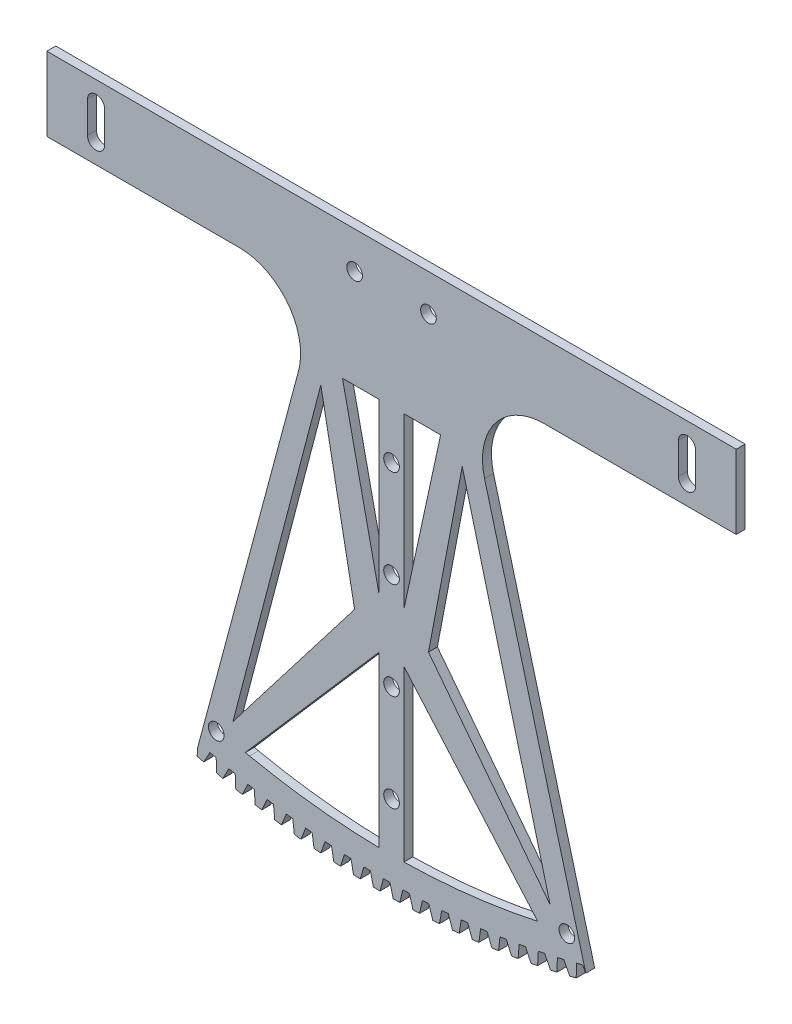
from build123d import *

# Parameters (mm, degrees)
BOSS_EXTRUDE2_DEPTH = 3.628571429
FILLET1_R           = 25
BOSS_EXTRUDE4_DEPTH = 3.628571429
CUT_EXTRUDE2_DEPTH  = 336.434355024
CIRPATTERN8_COUNT   = 20
CIRPATTERN8_ANGLE   = 28.5
SKETCH5_R           = 3.175
CUT_EXTRUDE3_DEPTH  = 338.743409804
SKETCH17_R          = 3.175
CUT_EXTRUDE4_DEPTH  = 338.743409804


with BuildPart() as part:
    # Sketch3 → Boss-Extrude2 (new body)
    with BuildSketch(Plane.XY):
        with BuildLine():
            Line((-140, -79.56), (-140, -109.56))
            Line((-140, -109.56), (-29.356513523, -109.56))
            Line((-29.356513523, -109.56), (-78.888044947, -294.414191853))
            ThreePointArc((-78.888044947, -294.414191853), (0, -304.8), (78.888044947, -294.414191853))
            Line((78.888044947, -294.414191853), (29.356513523, -109.56))
            Line((29.356513523, -109.56), (140, -109.56))
            Line((140, -109.56), (140, -79.56))
            Line((140, -79.56), (-140, -79.56))
        make_face()
    extrude(amount=BOSS_EXTRUDE2_DEPTH)

    # Fillet1
    fillet1_edges = [part.edges().sort_by_distance(p)[0] for p in [
        (29.356513523, -109.56, 1.814285714),
        (-29.356513523, -109.56, 1.814285714),
    ]]
    fillet(fillet1_edges, radius=FILLET1_R)

    # Sketch14 → Boss-Extrude4 (add)
    with BuildSketch(Plane(origin=(0, 0, 0), x_dir=(-1, 0, 0), z_dir=(0, 0, -1))):
        with BuildLine():
            Line((78.910933272, -297.036934084), (78.888044947, -294.414191853))
            ThreePointArc((78.888044947, -294.414191853), (76.959432674, -294.924203351), (75.027523715, -295.421581279))
            Line((75.027523715, -295.421581279), (76.289081309, -297.721097125))
            Line((76.289081309, -297.721097125), (78.910933272, -297.036934084))
        make_face()
    boss_extrude4 = extrude(amount=-BOSS_EXTRUDE4_DEPTH)

    # Sketch16 → Cut-Extrude2 (cut, symmetric)
    with BuildSketch(Plane(origin=(0, 0, 0), x_dir=(-1, 0, 0), z_dir=(0, 0, -1))):
        Polygon((372.937709596, -838.440145613), (75.027523715, -295.421581279), (73.765262731, -293.12078332), (71.19993834, -293.754449124), (71.154137831, -296.378353915), (60.344615656, -915.654378233), (357.400151379, -2118.250141136), (669.993245319, -2041.035908516), align=None)
    cut_extrude2 = extrude(amount=CUT_EXTRUDE2_DEPTH, both=True, mode=Mode.SUBTRACT)

    # CirPattern8: Boss-Extrude4, Cut-Extrude2 ×20 about axis
    cirpattern8_axis = Axis((0, 0, 0), (0, 0, 1))
    add([boss_extrude4.rotate(cirpattern8_axis, i * CIRPATTERN8_ANGLE / (CIRPATTERN8_COUNT - 1)) for i in range(1, CIRPATTERN8_COUNT)])
    add([cut_extrude2.rotate(cirpattern8_axis, i * CIRPATTERN8_ANGLE / (CIRPATTERN8_COUNT - 1)) for i in range(1, CIRPATTERN8_COUNT)], mode=Mode.SUBTRACT)

    # Sketch5 → Cut-Extrude3 (cut, through all)
    with BuildSketch(Plane(origin=(0, 0, 0), x_dir=(-1, 0, 0), z_dir=(0, 0, -1))):
        with Locations((-15, -94.56)):
            Circle(SKETCH5_R)
        with Locations((15, -94.56)):
            Circle(SKETCH5_R)
        with BuildLine():
            Line((-123.5, -94.56), (-123.5, -100.91))
            ThreePointArc((-123.5, -100.91), (-120, -104.41), (-116.5, -100.91))
            Line((-116.5, -100.91), (-116.5, -94.56))
            Line((-116.5, -94.56), (-116.5, -88.21))
            ThreePointArc((-116.5, -88.21), (-120, -84.71), (-123.5, -88.21))
            Line((-123.5, -88.21), (-123.5, -94.56))
        make_face()
        with BuildLine():
            Line((116.5, -94.56), (116.5, -88.21))
            ThreePointArc((116.5, -88.21), (120, -84.71), (123.5, -88.21))
            Line((123.5, -88.21), (123.5, -94.56))
            Line((123.5, -94.56), (123.5, -100.91))
            ThreePointArc((123.5, -100.91), (120, -104.41), (116.5, -100.91))
            Line((116.5, -100.91), (116.5, -94.56))
        make_face()
    extrude(amount=-CUT_EXTRUDE3_DEPTH, mode=Mode.SUBTRACT)

    # Sketch17 → Cut-Extrude4 (cut, through all)
    with BuildSketch(Plane(origin=(0, 0, 0), x_dir=(-1, 0, 0), z_dir=(0, 0, -1))):
        Polygon((-28.711660115, -141.33134449), (-64.419853025, -277.589898046), (-15, -213.409642912), align=None)
        Polygon((15, -213.409642912), (64.419853025, -277.589898046), (28.711660115, -141.33134449), align=None)
        with BuildLine():
            Line((57.677925946, -286.294618468), (59.356743472, -285.913498464))
            Line((59.356743472, -285.913498464), (5, -223.409642912))
            Line((5, -223.409642912), (5, -292.259285824))
            ThreePointArc((5, -292.259285824), (31.480548191, -290.527384931), (57.677925946, -286.294618468))
        make_face()
        with BuildLine():
            Line((-5, -223.409642912), (-59.372890863, -285.932066063))
            ThreePointArc((-59.372890863, -285.932066063), (-32.341547535, -290.428544105), (-5, -292.259285824))
            Line((-5, -292.259285824), (-5, -223.409642912))
        make_face()
        Polygon((5, -203.409642912), (19.937147844, -134.56), (5, -134.56), align=None)
        Polygon((-19.937147844, -134.56), (-5, -203.409642912), (-5, -134.56), align=None)
        with Locations((0, -193.697232184)):
            Circle(SKETCH17_R)
        with Locations((0, -154.272410728)):
            Circle(SKETCH17_R)
        with Locations((0, -233.12205364)):
            Circle(SKETCH17_R)
        with Locations((0, -272.546875096)):
            Circle(SKETCH17_R)
        with Locations((71.194365296, -284.361242536)):
            Circle(SKETCH17_R)
        with Locations((-71.194365296, -284.361242536)):
            Circle(SKETCH17_R)
    extrude(amount=-CUT_EXTRUDE4_DEPTH, mode=Mode.SUBTRACT)


solid = part.part
